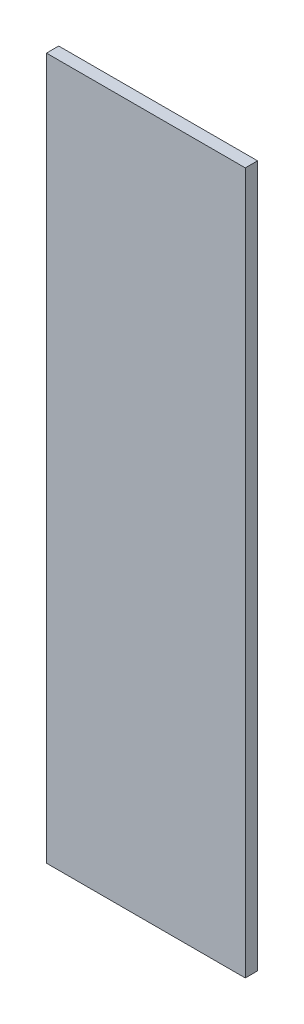
from build123d import *

# Parameters (mm, degrees)
SKETCH_1_W      = 649
SKETCH_1_H      = 2290
EXTRUDE_1_DEPTH = 40


with BuildPart() as part:
    # Эскиз1 → Бобышка-Вытянуть1 (new body)
    with BuildSketch(Plane.XY):
        with Locations((-647.078947368, -83.157894737)):
            Rectangle(SKETCH_1_W, SKETCH_1_H)
    extrude(amount=EXTRUDE_1_DEPTH)


solid = part.part
